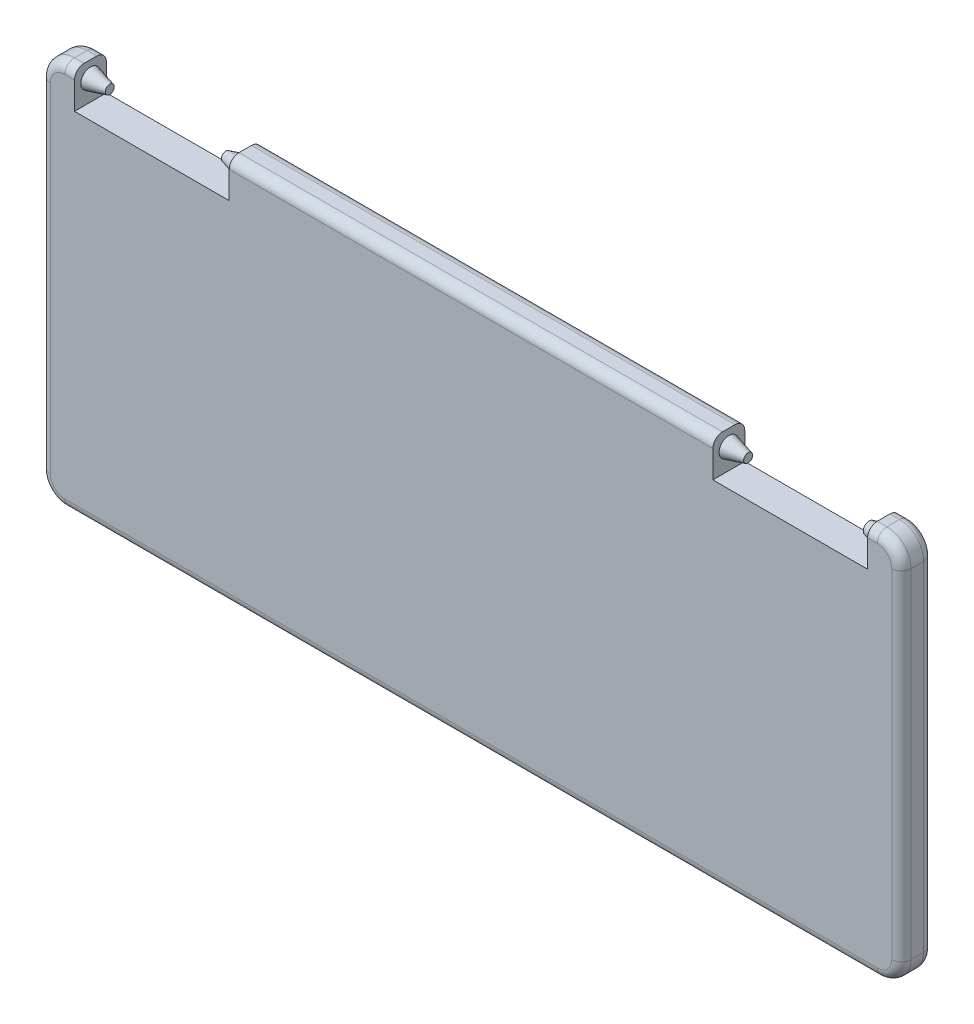
from build123d import *

# Parameters (mm, degrees)
SKETCH1_W           = 178
SKETCH1_H           = 80
BOSS_EXTRUDE1_DEPTH = 6.6
FILLET1_R           = 5
SKETCH5_W           = 32
SKETCH5_H           = 7.6
CUT_EXTRUDE1_DEPTH  = 6.6
SKETCH13_R          = 2
BOSS_EXTRUDE2_DEPTH = 4
BOSS_EXTRUDE2_TAPER = 15
SKETCH10_R          = 2
BOSS_EXTRUDE5_DEPTH = 4
BOSS_EXTRUDE5_TAPER = 15
SKETCH9_R           = 2
BOSS_EXTRUDE6_DEPTH = 4
BOSS_EXTRUDE6_TAPER = 15
SKETCH6_R           = 2
BOSS_EXTRUDE9_DEPTH = 3
BOSS_EXTRUDE9_TAPER = 15
ZAOBLIT4_R          = 2


with BuildPart() as part:
    # Sketch1 → Boss-Extrude1 (new body)
    with BuildSketch(Plane.XY):
        with Locations((89, 40)):
            Rectangle(SKETCH1_W, SKETCH1_H)
    extrude(amount=BOSS_EXTRUDE1_DEPTH)

    # Fillet1
    fillet1_edges = [part.edges().sort_by_distance(p)[0] for p in [
        (0, 80, 3.3),
        (178, 80, 3.3),
        (178, 0, 3.3),
        (0, 0, 3.3),
    ]]
    fillet(fillet1_edges, radius=FILLET1_R)

    # Sketch5 → Cut-Extrude1 (cut)
    with BuildSketch(Plane.XY.offset(6.6)):
        with Locations((23, 76.2)):
            Rectangle(SKETCH5_W, SKETCH5_H)
        with Locations((155, 76.2)):
            Rectangle(SKETCH5_W, SKETCH5_H)
    extrude(amount=-CUT_EXTRUDE1_DEPTH, mode=Mode.SUBTRACT)

    # Sketch13 → Boss-Extrude2 (add)
    with BuildSketch(Plane(origin=(139, 0, 0), x_dir=(0, 0, -1), z_dir=(1, 0, 0))):
        with Locations((-3.3, 76.7)):
            Circle(SKETCH13_R)
    extrude(amount=BOSS_EXTRUDE2_DEPTH, taper=BOSS_EXTRUDE2_TAPER)

    # Sketch10 → Boss-Extrude5 (add)
    with BuildSketch(Plane(origin=(7, 0, 0), x_dir=(0, 0, -1), z_dir=(1, 0, 0))):
        with Locations((-3.3, 76.7)):
            Circle(SKETCH10_R)
    extrude(amount=BOSS_EXTRUDE5_DEPTH, taper=BOSS_EXTRUDE5_TAPER)

    # Sketch9 → Boss-Extrude6 (add)
    with BuildSketch(Plane.ZY.offset(-39)):
        with Locations((3.3, 76.7)):
            Circle(SKETCH9_R)
    extrude(amount=BOSS_EXTRUDE6_DEPTH, taper=BOSS_EXTRUDE6_TAPER)

    # Sketch6 → Boss-Extrude9 (add)
    with BuildSketch(Plane.ZY.offset(-171)):
        with Locations((3.3, 76.7)):
            Circle(SKETCH6_R)
    extrude(amount=BOSS_EXTRUDE9_DEPTH, taper=BOSS_EXTRUDE9_TAPER)

    # Zaoblit4
    zaoblit4_edges = [part.edges().sort_by_distance(p)[0] for p in [
        (172, 80, 0),
        (172, 80, 6.6),
        (0, 40, 0),
        (178, 40, 0),
        (89, 0, 0),
        (1.464466094, 1.464466094, 0),
        (176.535533906, 1.464466094, 0),
        (1.464466094, 78.535533906, 0),
        (176.535533906, 78.535533906, 0),
        (178, 40, 6.6),
        (0, 40, 6.6),
        (89, 0, 6.6),
        (1.464466094, 1.464466094, 6.6),
        (176.535533906, 1.464466094, 6.6),
        (1.464466094, 78.535533906, 6.6),
        (176.535533906, 78.535533906, 6.6),
        (89, 80, 0),
        (6, 80, 0),
        (89, 80, 6.6),
        (6, 80, 6.6),
    ]]
    fillet(zaoblit4_edges, radius=ZAOBLIT4_R)


solid = part.part
